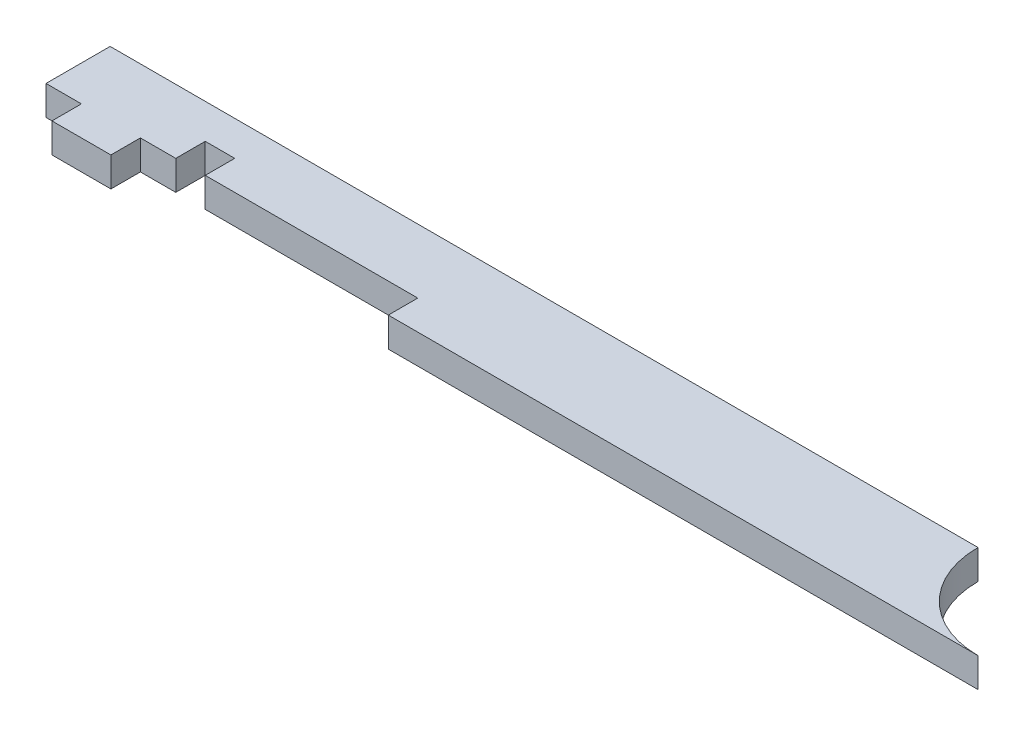
from build123d import *

# Parameters (mm, degrees)
BOSS_EXTRUDE1_DEPTH = 2.5


with BuildPart() as part:
    # Sketch1 → Boss-Extrude1 (new, symmetric)
    with BuildSketch(Plane(origin=(0, 0, 0), x_dir=(-1, 0, 0), z_dir=(0, 1, 0))):
        with BuildLine():
            ThreePointArc((0, 15.875), (11.225320151, 11.225320151), (15.875, 0))
            Line((15.875, 0), (163.044989153, 0))
            Line((163.044989153, 0), (163.044989153, 10.875))
            Line((163.044989153, 10.875), (157.04, 10.875))
            Line((157.04, 10.875), (157.04, 15.875))
            Line((157.04, 15.875), (147.04, 15.875))
            Line((147.04, 15.875), (147.04, 10.875))
            Line((147.04, 10.875), (141.04, 10.875))
            Line((141.04, 10.875), (141.04, 5.875))
            Line((141.04, 5.875), (136.04, 5.875))
            Line((136.04, 5.875), (136.04, 10.875))
            Line((136.04, 10.875), (100, 10.875))
            Line((100, 10.875), (100, 15.875))
            Line((100, 15.875), (0, 15.875))
        make_face()
    extrude(amount=BOSS_EXTRUDE1_DEPTH, both=True)


solid = part.part
